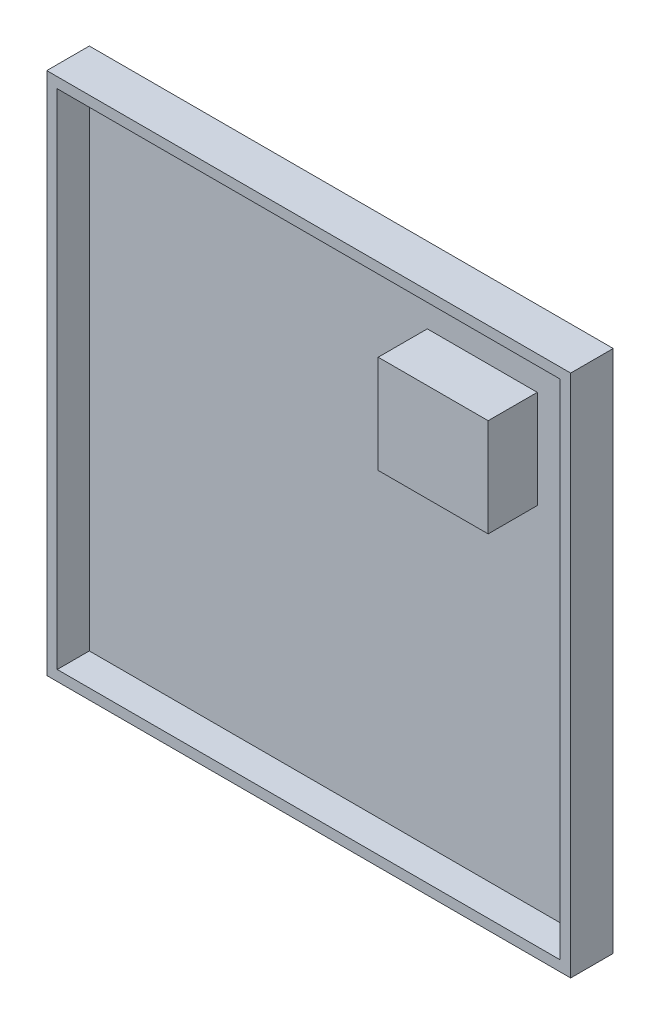
from build123d import *

# Parameters (mm, degrees)
SKETCH1_W           = 101.6
SKETCH1_H           = 101.6
BOSS_EXTRUDE1_DEPTH = 8.255
SKETCH3_W           = 97.536
SKETCH3_H           = 97.536
CUT_EXTRUDE1_DEPTH  = 6.223
SKETCH4_W           = 21.321387129
SKETCH4_H           = 19.016372304
BOSS_EXTRUDE2_DEPTH = 9.525
SKETCH6_W           = 17.257387129
SKETCH6_H           = 14.952372304
CUT_EXTRUDE2_DEPTH  = 9.525


with BuildPart() as part:
    # Sketch1 → Boss-Extrude1 (new body)
    with BuildSketch(Plane.XY):
        Rectangle(SKETCH1_W, SKETCH1_H)
    extrude(amount=BOSS_EXTRUDE1_DEPTH)

    # Sketch3 → Cut-Extrude1 (cut)
    with BuildSketch(Plane.XY.offset(8.255)):
        Rectangle(SKETCH3_W, SKETCH3_H)
    extrude(amount=-CUT_EXTRUDE1_DEPTH, mode=Mode.SUBTRACT)

    # Sketch4 → Boss-Extrude2 (add)
    with BuildSketch(Plane.XY.offset(2.032)):
        with Locations((27.439306436, 28.591813848)):
            Rectangle(SKETCH4_W, SKETCH4_H)
    extrude(amount=BOSS_EXTRUDE2_DEPTH)

    # Sketch6 → Cut-Extrude2 (cut)
    with BuildSketch(Plane(origin=(0, 0, 0), x_dir=(-1, 0, 0), z_dir=(0, 0, -1))):
        with Locations((-27.439306436, 28.591813848)):
            Rectangle(SKETCH6_W, SKETCH6_H)
    extrude(amount=-CUT_EXTRUDE2_DEPTH, mode=Mode.SUBTRACT)


solid = part.part
